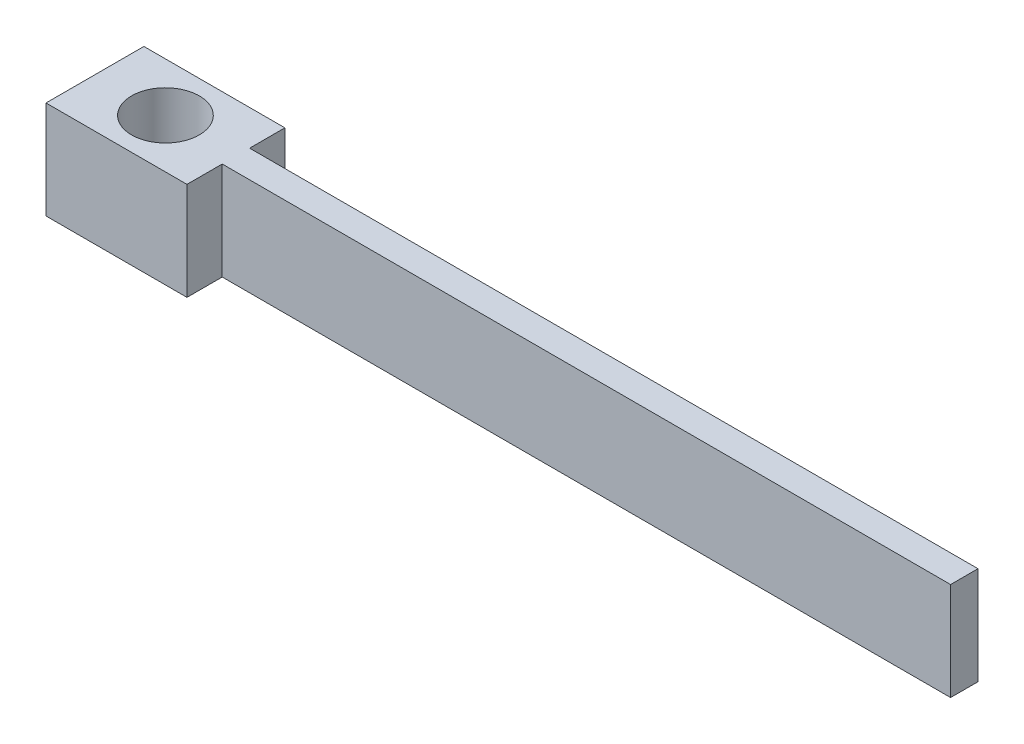
from build123d import *

# Parameters (mm, degrees)
SKETCH1_W                   = 56.388
SKETCH1_H                   = 6.35
BOSS_EXTRUDE1_DEPTH         = 3.175
F_17_0_173_DIAMETER_HOLE1_D = 4.3942
SKETCH4_W                   = 47.244
SKETCH4_H                   = 2.286
CUT_EXTRUDE1_DEPTH          = 30.074125283


with BuildPart() as part:
    # Sketch1 → Boss-Extrude1 (new, symmetric)
    with BuildSketch(Plane(origin=(0, 0, 0), x_dir=(1, 0, 0), z_dir=(0, 1, 0))):
        Rectangle(SKETCH1_W, SKETCH1_H)
    extrude(amount=BOSS_EXTRUDE1_DEPTH, both=True)

    # #17 (0.173) Diameter Hole1 (through all)
    with Locations(Plane(origin=(0, 3.175, 0), x_dir=(1, 0, 0), z_dir=(0, 1, 0))):
        with Locations((-23.622, 0)):
            Hole(F_17_0_173_DIAMETER_HOLE1_D / 2)

    # Sketch4 → Cut-Extrude1 (cut, through all)
    with BuildSketch(Plane(origin=(0, 3.175, 0), x_dir=(1, 0, 0), z_dir=(0, 1, 0))):
        with Locations((4.572, 2.032)):
            Rectangle(SKETCH4_W, SKETCH4_H)
    cut_extrude1 = extrude(amount=-CUT_EXTRUDE1_DEPTH, mode=Mode.SUBTRACT)

    # Mirror1: Cut-Extrude1 across plane
    add(cut_extrude1.mirror(Plane.XY), mode=Mode.SUBTRACT)


solid = part.part
